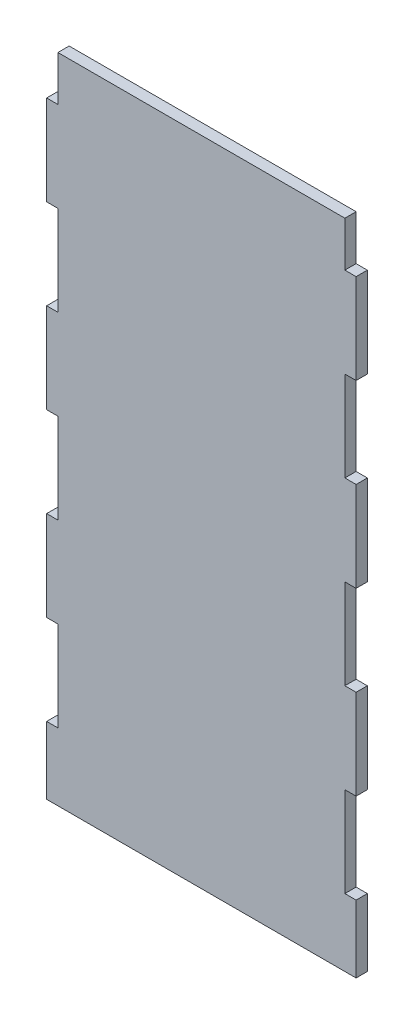
from build123d import *

# Parameters (mm, degrees)
BOSS_EXTRUDE1_DEPTH = 3.175


with BuildPart() as part:
    # Sketch1 → Boss-Extrude1 (new body)
    with BuildSketch(Plane.XY):
        Polygon((0, 139.7), (-3.175, 139.7), (-3.175, 114.3), (0, 114.3), (0, 88.9), (-3.175, 88.9), (-3.175, 63.5), (0, 63.5), (0, 38.1), (-3.175, 38.1), (-3.175, 12.7), (0, 12.7), (0, 0), (0, -12.7), (-3.175, -12.7), (-3.175, -31.75), (84.175, -31.75), (84.175, -12.7), (81, -12.7), (81, 0), (81, 12.7), (84.175, 12.7), (84.175, 38.1), (81, 38.1), (81, 63.5), (84.175, 63.5), (84.175, 88.9), (81, 88.9), (81, 114.3), (84.175, 114.3), (84.175, 139.7), (81, 139.7), (81, 152.4), (0, 152.4), align=None)
    extrude(amount=BOSS_EXTRUDE1_DEPTH)


solid = part.part
